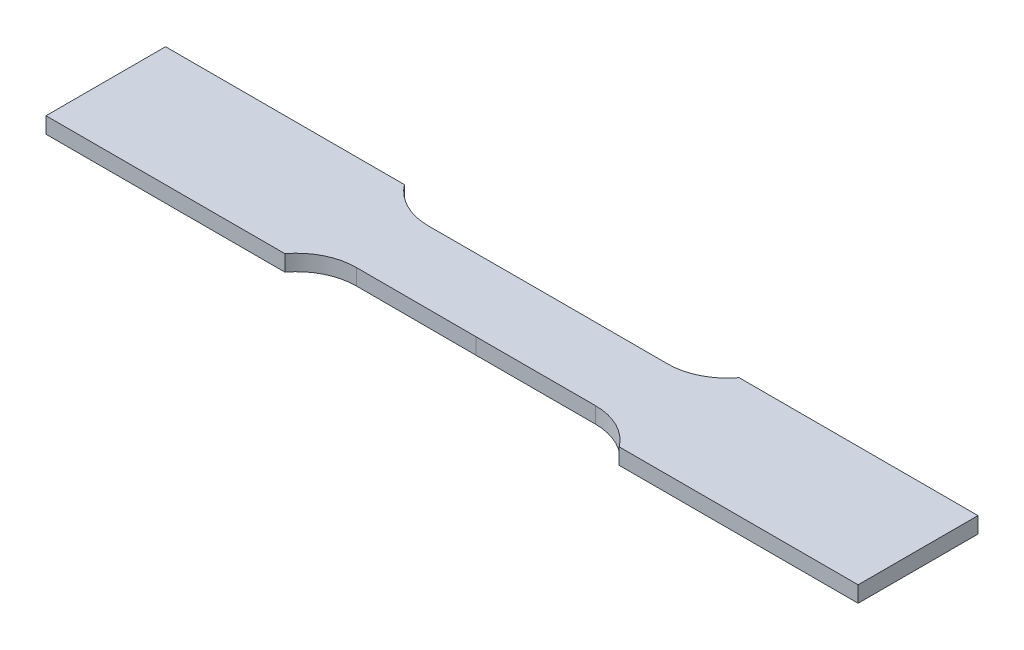
from build123d import *

# Parameters (mm, degrees)
BOSS_EXTRUDE2_DEPTH = 3.357


with BuildPart() as part:
    # Sketch1 → Boss-Extrude2 (new body)
    with BuildSketch(Plane(origin=(0, 0, 0), x_dir=(1, 0, 0), z_dir=(0, 1, 0))):
        with BuildLine():
            Line((35, 12.545008155), (85, 12.545008155))
            Line((85, 12.545008155), (85, -12.545008155))
            Line((85, -12.545008155), (35, -12.545008155))
            ThreePointArc((35, -12.545008155), (30.588727606, -8.870191163), (25, -7.555))
            Line((25, -7.555), (0, -7.57))
            Line((0, -7.57), (-25, -7.535))
            ThreePointArc((-25, -7.535), (-30.586810484, -8.844242442), (-35, -12.511710977))
            Line((-35, -12.511710977), (-85, -12.511710977))
            Line((-85, -12.511710977), (-85, 12.511710977))
            Line((-85, 12.511710977), (-35, 12.511710977))
            ThreePointArc((-35, 12.511710977), (-30.586810484, 8.844242442), (-25, 7.535))
            Line((-25, 7.535), (0, 7.57))
            Line((0, 7.57), (25, 7.555))
            ThreePointArc((25, 7.555), (30.588727606, 8.870191163), (35, 12.545008155))
        make_face()
    extrude(amount=BOSS_EXTRUDE2_DEPTH)


solid = part.part
